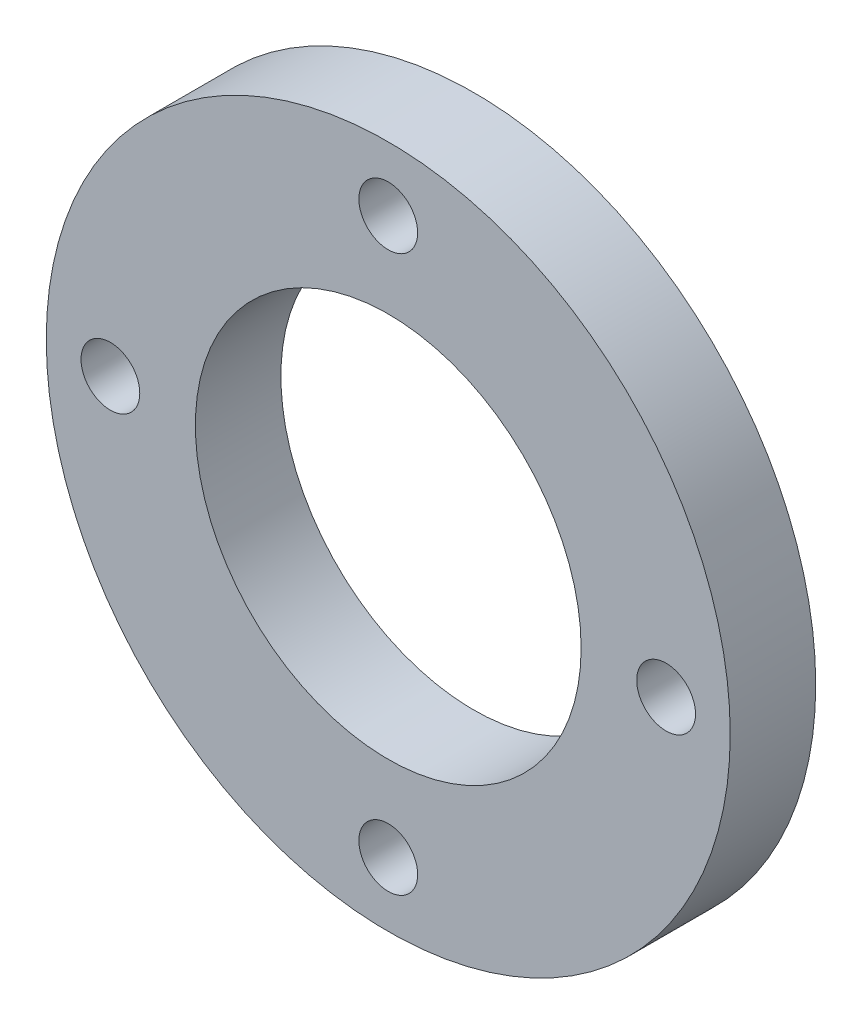
from build123d import *

# Parameters (mm, degrees)
SKETCH1_R           = 50.8
SKETCH1_R_2         = 28.6512
SKETCH1_R_3         = 4.365625
BOSS_EXTRUDE1_DEPTH = 12.7


with BuildPart() as part:
    # Sketch1 → Boss-Extrude1 (new body)
    with BuildSketch(Plane.XY):
        Circle(SKETCH1_R)
        Circle(SKETCH1_R_2, mode=Mode.SUBTRACT)
        with Locations((0, 41.275)):
            Circle(SKETCH1_R_3, mode=Mode.SUBTRACT)
        with Locations((41.275, 0)):
            Circle(SKETCH1_R_3, mode=Mode.SUBTRACT)
        with Locations((0, -41.275)):
            Circle(SKETCH1_R_3, mode=Mode.SUBTRACT)
        with Locations((-41.275, 0)):
            Circle(SKETCH1_R_3, mode=Mode.SUBTRACT)
    extrude(amount=BOSS_EXTRUDE1_DEPTH)


solid = part.part
